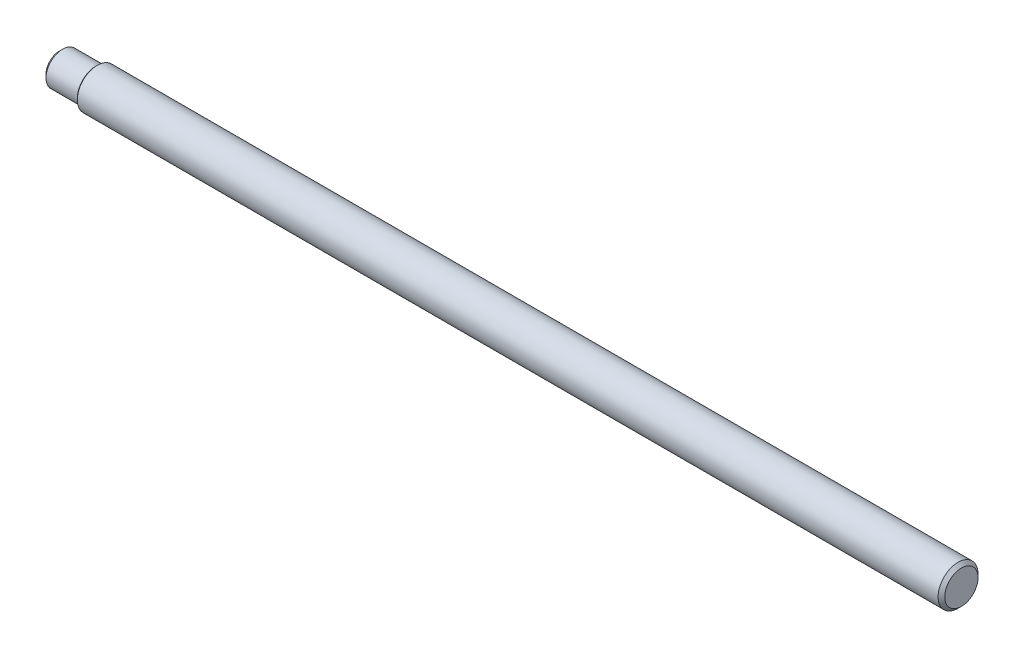
from build123d import *


with BuildPart() as part:
    # Sketch1 → Revolve1 (revolve)
    with BuildSketch(Plane.XY, mode=Mode.PRIVATE) as revolve1_sk:
        with BuildLine():
            Line((-5.5, 0), (-5.5, 2))
            Line((-5.5, 2), (-5, 2.5))
            Line((-5, 2.5), (-0.2, 2.5))
            ThreePointArc((-0.2, 2.5), (-0.058578644, 2.558578644), (0, 2.7))
            Line((0, 2.7), (0, 2.8))
            Line((0, 2.8), (0.2, 3))
            Line((0.2, 3), (129.5, 3))
            Line((129.5, 3), (130, 2.5))
            Line((130, 2.5), (130, 0))
            Line((130, 0), (-5.5, 0))
        make_face()
    revolve(revolve1_sk.sketch.rotate(Axis((130, 0, 0), (-1, 0, 0)), 270), axis=Axis((130, 0, 0), (-1, 0, 0)))


solid = part.part
